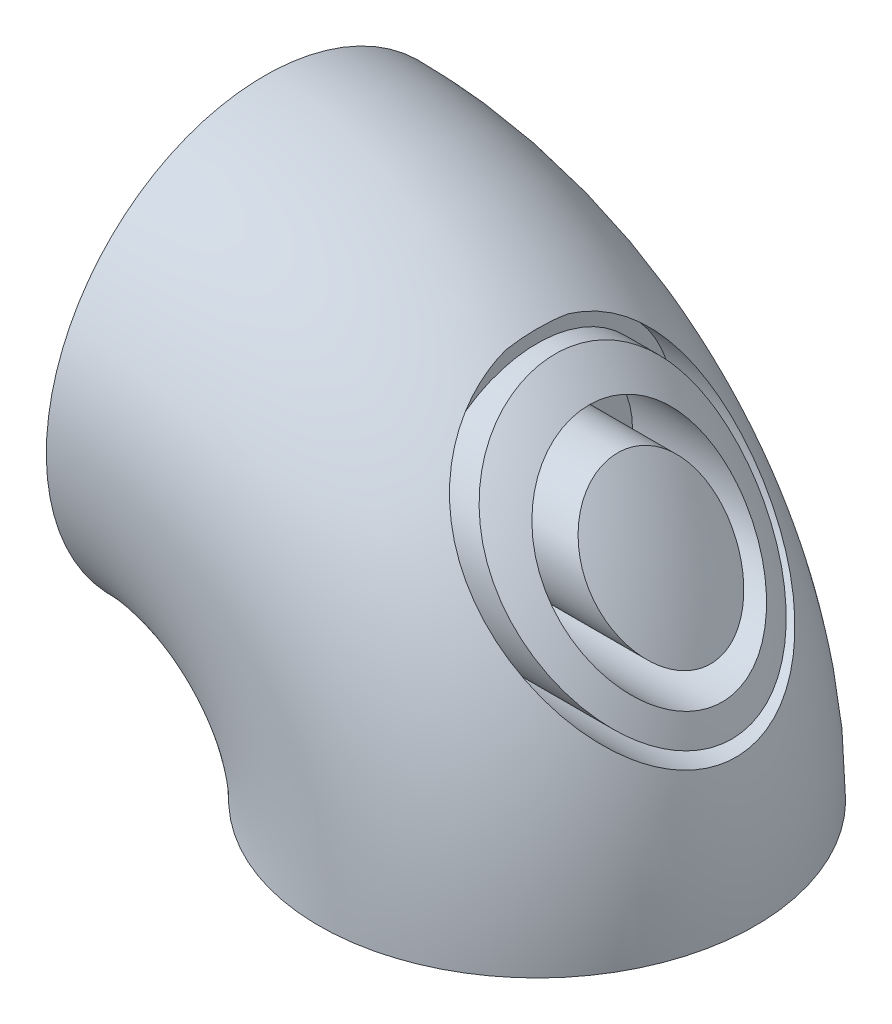
from build123d import *

# Parameters (mm, degrees)
SWEEP2_PROFILE_R    = 80
SKETCH11_R          = 25
CUT_EXTRUDE1_DEPTH  = 30
SKETCH12_R          = 25
BOSS_EXTRUDE1_DEPTH = 30
SKETCH13_R          = 50
SKETCH13_R_2        = 45
SKETCH13_R_3        = 35
SKETCH13_R_4        = 25
CUT_EXTRUDE2_DEPTH  = 237.008474534


with BuildPart() as part:
    # Sweep2: sweep along a path in Sketch1
    with BuildLine(Plane.XY) as sweep2_path:
        ThreePointArc((0, 0), (-29.289321881, 70.710678119), (-100, 100))
    # Sweep2 profile (on start of the path) → Sweep2 (sweep)
    with BuildSketch(Plane(origin=(0, 0, 0), x_dir=(1, 0, 0), z_dir=(0, 1, 0))):
        Circle(SWEEP2_PROFILE_R)
    sweep(path=sweep2_path.line)

    # Sketch11 → Cut-Extrude1 (cut)
    with BuildSketch(Plane.XZ):
        Circle(SKETCH11_R)
    extrude(amount=-CUT_EXTRUDE1_DEPTH, mode=Mode.SUBTRACT)

    # Sketch12 → Boss-Extrude1 (add)
    with BuildSketch(Plane.ZY.offset(100)):
        with Locations(Location((0, 100, 0), (0, 0, 270))):
            Circle(SKETCH12_R)
    extrude(amount=BOSS_EXTRUDE1_DEPTH)

    # Sketch13 → Cut-Extrude2 (cut, through all)
    # profile 1 of 2: a face of its own
    with BuildSketch(Plane(origin=(0, 0, 0), x_dir=(0, 0, -1), z_dir=(1, 0, 0))):
        with Locations((0, 100)):
            Circle(SKETCH13_R)
        with Locations(Location((0, 100, 0), (0, 0, 350.615107279))):
            Circle(SKETCH13_R_2, mode=Mode.SUBTRACT)
    # profile 2 of 2: a face of its own
    with BuildSketch(Plane(origin=(0, 0, 0), x_dir=(0, 0, -1), z_dir=(1, 0, 0))):
        with Locations(Location((0, 100, 0), (0, 0, 356.680271872))):
            Circle(SKETCH13_R_3)
        with Locations(Location((0, 100, 0), (0, 0, 270))):
            Circle(SKETCH13_R_4, mode=Mode.SUBTRACT)
    extrude(amount=CUT_EXTRUDE2_DEPTH, mode=Mode.SUBTRACT)


solid = part.part
